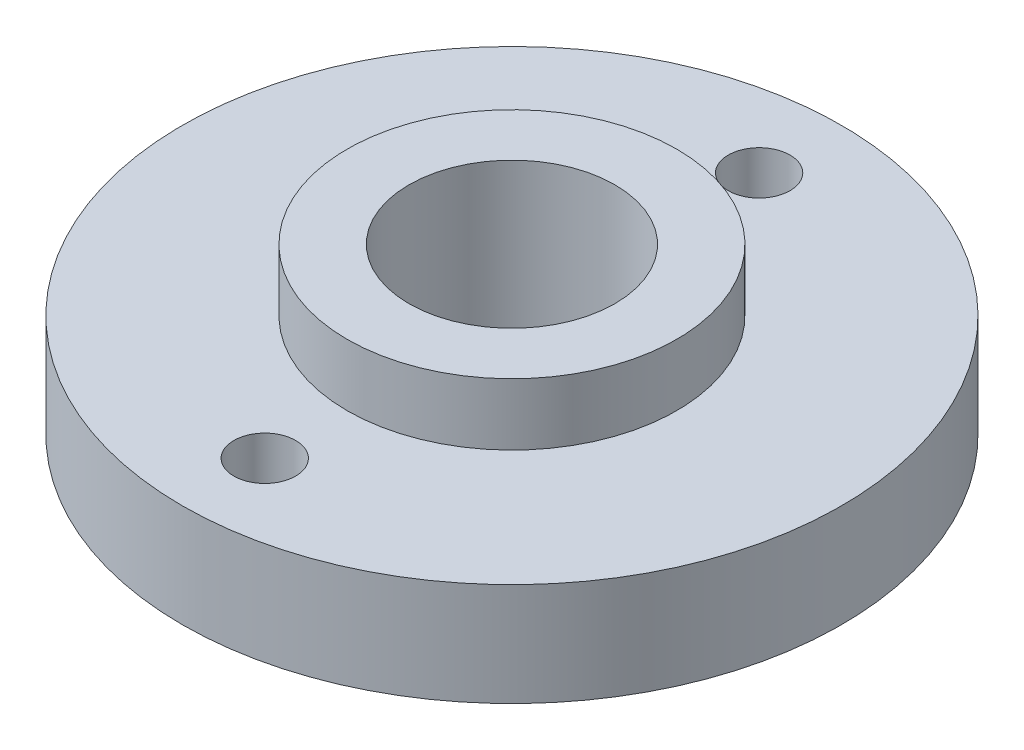
from build123d import *

# Parameters (mm, degrees)
SKETCH_3_R          = 1.5
CUT_EXTRUDE_4_DEPTH = 24.173260453
SKETCH_3_4_R        = 1.5
CUT_EXTRUDE_5_DEPTH = 24.173260453


with BuildPart() as part:
    # Эскиз2 → Повернуть1 (revolve)
    with BuildSketch(Plane(origin=(0, 0, 0), x_dir=(0, 0, -1), z_dir=(1, 0, 0))):
        Polygon((5, 0), (16, 0), (16, 5), (8, 5), (8, 8), (5, 8), align=None)
    revolve(axis=Axis((0, 18.095647444, 0), (0, -1, 0)))

    # Эскиз3 → Вырез-Вытянуть4 (cut, through all)
    with BuildSketch(Plane(origin=(0, 5, 0), x_dir=(1, 0, 0), z_dir=(0, 1, 0))):
        with Locations((0, 12)):
            Circle(SKETCH_3_R)
    extrude(amount=-CUT_EXTRUDE_4_DEPTH, mode=Mode.SUBTRACT)

    # Эскиз3<4> → Вырез-Вытянуть5 (cut, through all)
    with BuildSketch(Plane(origin=(0, 5, 0), x_dir=(1, 0, 0), z_dir=(0, 1, 0))):
        with Locations((0, -12)):
            Circle(SKETCH_3_4_R)
    extrude(amount=-CUT_EXTRUDE_5_DEPTH, mode=Mode.SUBTRACT)


solid = part.part
